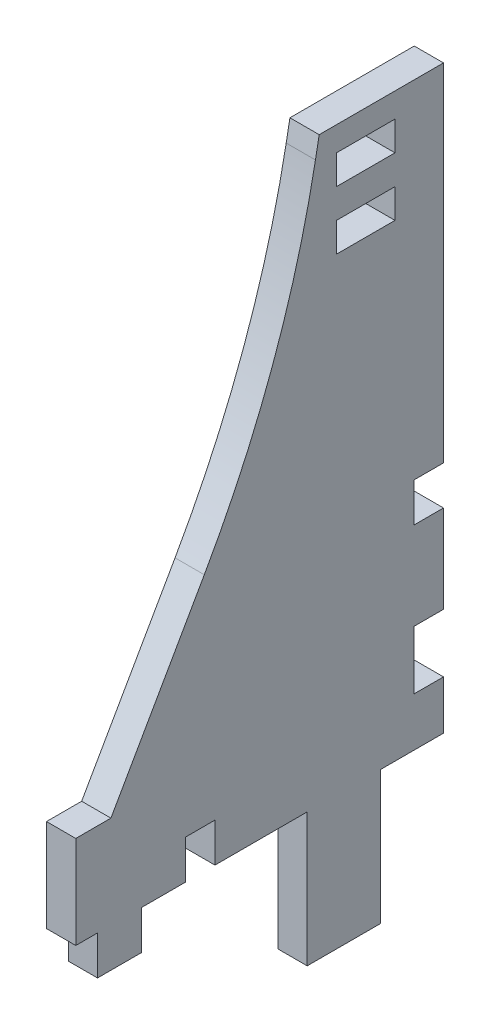
from build123d import *

# Parameters (mm, degrees)
SKETCH1_W           = 12
SKETCH1_H           = 6
BOSS_EXTRUDE1_DEPTH = 6


with BuildPart() as part:
    # Sketch1 → Boss-Extrude1 (new body)
    with BuildSketch(Plane(origin=(0, 0, 0), x_dir=(0, 0, -1), z_dir=(1, 0, 0))):
        with BuildLine():
            Line((86.321496787, 73.422774132), (60.826091075, 73.422774132))
            Line((60.826091075, 73.422774132), (60.060334343, 69.316135154))
            ThreePointArc((60.060334343, 69.316135154), (51.261909479, 37.228978051), (37.265778766, 7.044441347))
            Line((37.265778766, 7.044441347), (18.112573434, -26.605921739))
            Line((18.112573434, -26.605921739), (10.903253971, -26.605921739))
            Line((10.903253971, -26.605921739), (10.903253971, -45.622400338))
            Line((10.903253971, -45.622400338), (15.367545377, -45.622400338))
            Line((15.367545377, -45.622400338), (15.367545377, -53.626330222))
            Line((15.367545377, -53.626330222), (24.367545377, -53.626330222))
            Line((24.367545377, -53.626330222), (24.367545377, -45.622400338))
            Line((24.367545377, -45.622400338), (33.453304177, -45.622400338))
            Line((33.453304177, -45.622400338), (33.453304177, -37.622400338))
            Line((33.453304177, -37.622400338), (39.453304177, -37.622400338))
            Line((39.453304177, -37.622400338), (39.453304177, -45.622400338))
            Line((39.453304177, -45.622400338), (58.367545377, -45.622400338))
            Line((58.367545377, -45.622400338), (58.367545377, -72.9735186))
            Line((58.367545377, -72.9735186), (73.367545377, -72.9735186))
            Line((73.367545377, -72.9735186), (73.367545377, -45.622400338))
            Line((73.367545377, -45.622400338), (86.321496787, -45.622400338))
            Line((86.321496787, -45.622400338), (86.321496787, -35.622400338))
            Line((86.321496787, -35.622400338), (80.321496787, -35.622400338))
            Line((80.321496787, -35.622400338), (80.321496787, -23.622400338))
            Line((80.321496787, -23.622400338), (86.321496787, -23.622400338))
            Line((86.321496787, -23.622400338), (86.321496787, -5.622400338))
            Line((86.321496787, -5.622400338), (80.321496787, -5.622400338))
            Line((80.321496787, -5.622400338), (80.321496787, 2.377599662))
            Line((80.321496787, 2.377599662), (86.321496787, 2.377599662))
            Line((86.321496787, 2.377599662), (86.321496787, 73.422774132))
        make_face()
        with Locations((70.374836387, 65.422774132)):
            Rectangle(SKETCH1_W, SKETCH1_H, mode=Mode.SUBTRACT)
        with Locations((70.374836387, 53.422774132)):
            Rectangle(SKETCH1_W, SKETCH1_H, mode=Mode.SUBTRACT)
    extrude(amount=BOSS_EXTRUDE1_DEPTH)


solid = part.part
